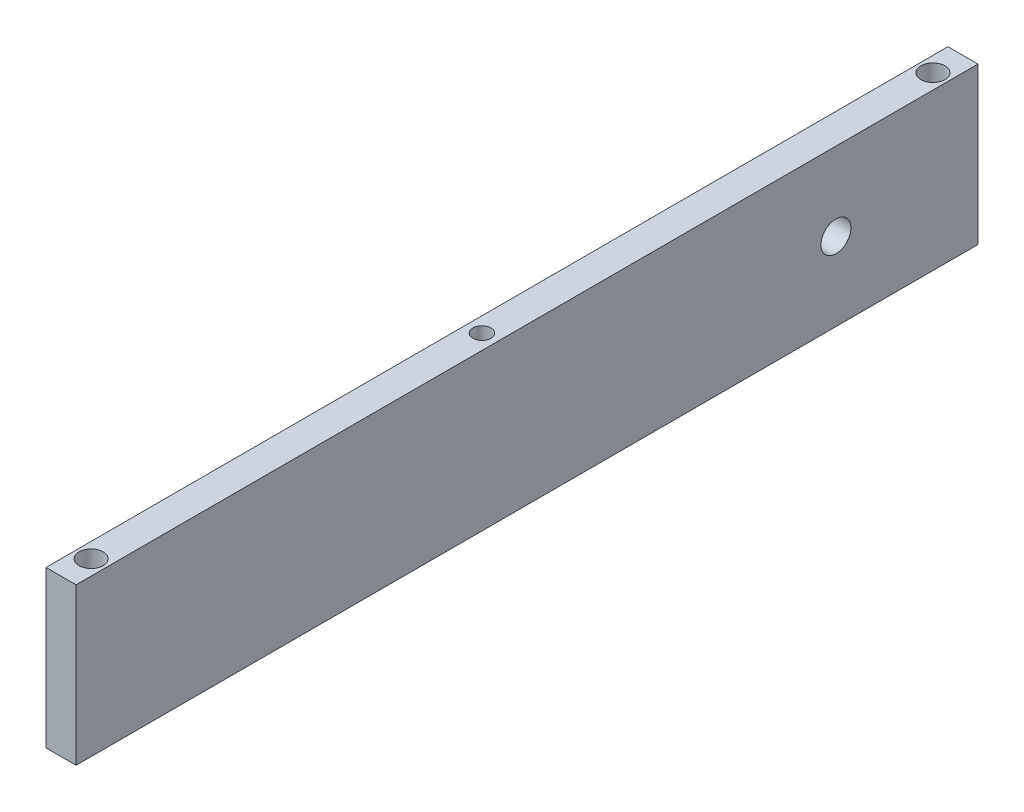
from build123d import *

# Parameters (mm, degrees)
SKETCH1_W           = 6.35
SKETCH1_H           = 33.02
BOSS_EXTRUDE1_DEPTH = 190.5
CUT_EXTRUDE1_REACH  = 195.445
SKETCH2_R           = 3.175
SKETCH3_R           = 2.54
SKETCH3_R_2         = 1.905
CUT_EXTRUDE2_DEPTH  = 194.444805823


with BuildPart() as part:
    # Sketch1 → Boss-Extrude1 (new body)
    with BuildSketch(Plane.XY):
        with Locations((-3.175, 16.51)):
            Rectangle(SKETCH1_W, SKETCH1_H)
    extrude(amount=-BOSS_EXTRUDE1_DEPTH)

    # Sketch2 → Cut-Extrude1 (cut, up to next)
    with BuildSketch(Plane.ZY.offset(6.35), mode=Mode.PRIVATE) as cut_extrude1_sk1:
        with Locations(Location((-160.5000092, 16.51, 0), (0, 0, 270))):
            Circle(SKETCH2_R)
    cut_extrude1_tool1 = extrude(cut_extrude1_sk1.sketch, amount=-CUT_EXTRUDE1_REACH, mode=Mode.PRIVATE) & part.part
    add(cut_extrude1_tool1.solids().sort_by_distance((-6.35, 16.51, -160.500009))[0], mode=Mode.SUBTRACT)

    # Sketch3 → Cut-Extrude2 (cut, through all)
    with BuildSketch(Plane(origin=(0, 33.02, 0), x_dir=(1, 0, 0), z_dir=(0, 1, 0))):
        with Locations(Location((-3.175, 6.35, 0), (0, 0, 270))):
            Circle(SKETCH3_R)
        with Locations(Location((-3.175, 184.15, 0), (0, 0, 270))):
            Circle(SKETCH3_R)
        with Locations(Location((-3.175, 88.9, 0), (0, 0, 270))):
            Circle(SKETCH3_R_2)
    extrude(amount=-CUT_EXTRUDE2_DEPTH, mode=Mode.SUBTRACT)


solid = part.part
